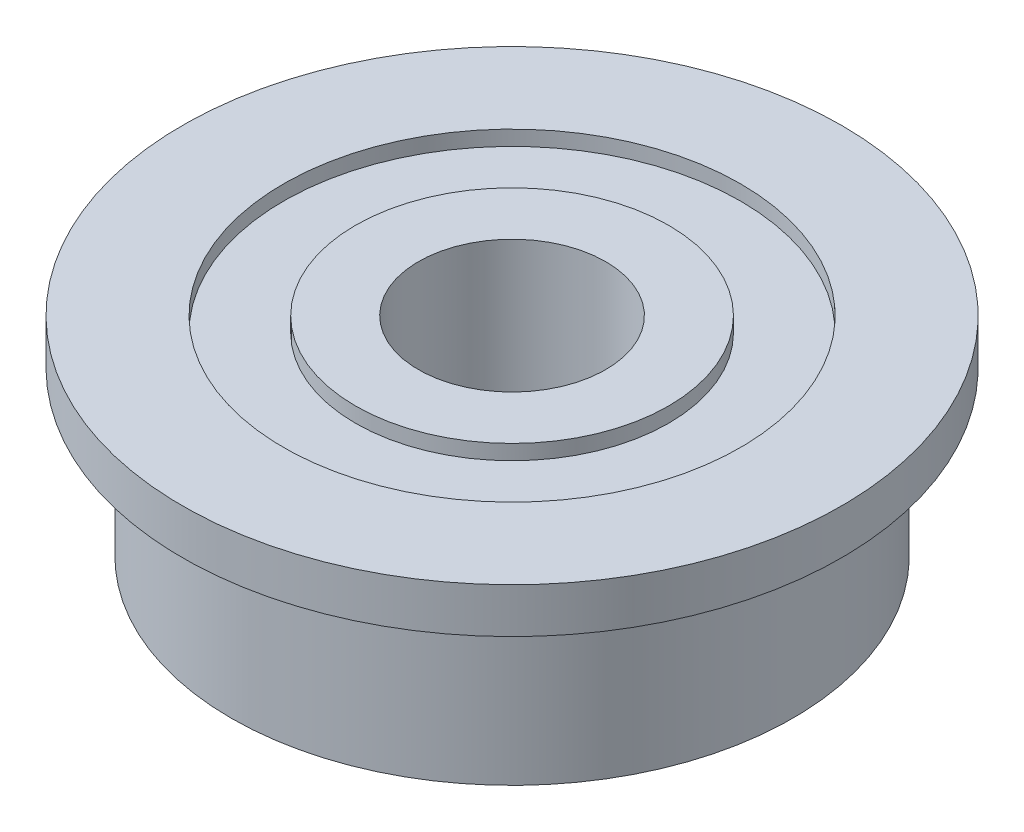
from build123d import *


with BuildPart() as part:
    # Sketch1 → Revolve1 (revolve)
    with BuildSketch(Plane.XY, mode=Mode.PRIVATE) as revolve1_sk:
        Polygon((2.6543, 0), (2.6543, 0.254), (3.8735, 0.254), (3.8735, 0), (4.7625, 0), (4.7625, 2.7686), (5.588, 2.7686), (5.588, 3.5306), (3.8735, 3.5306), (3.8735, 3.2766), (2.6543, 3.2766), (2.6543, 3.5306), (1.5875, 3.5306), (1.5875, 0), align=None)
    revolve(revolve1_sk.sketch.rotate(Axis((0, 3.5306, 0), (0, -1, 0)), 270), axis=Axis((0, 3.5306, 0), (0, -1, 0)))


solid = part.part
